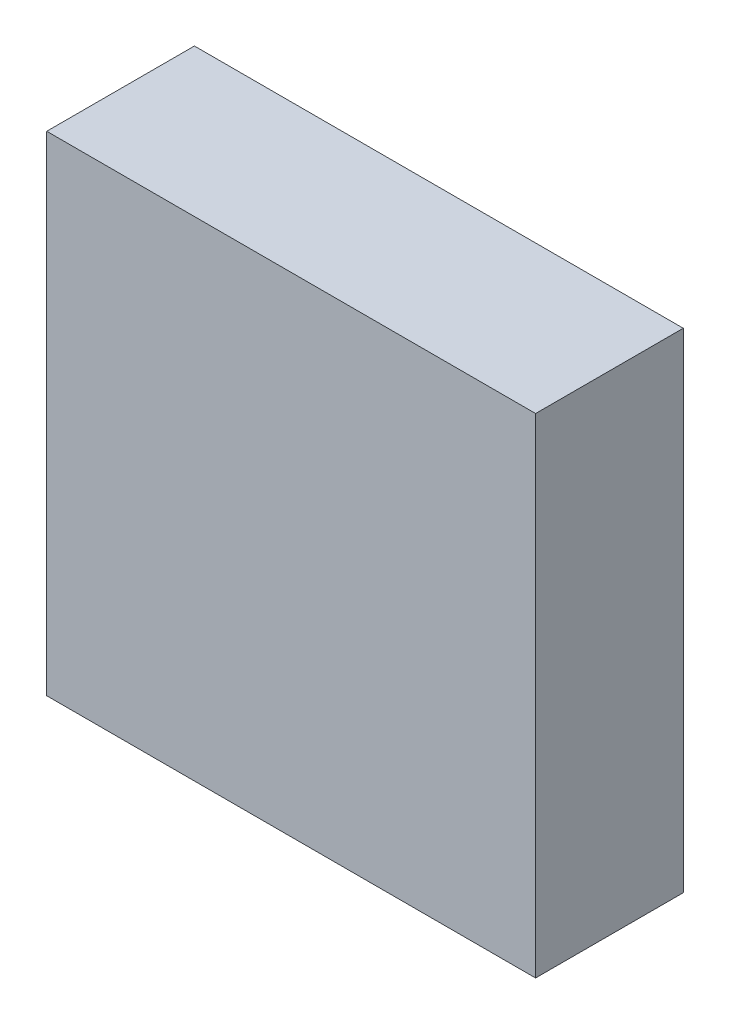
from build123d import *

# Parameters (mm, degrees)
SKETCH_1_W           = 36
SKETCH_1_H           = 36
SCREW_FOOT_PAD_DEPTH = 10.875238336


with BuildPart() as part:
    # 草图1 → Screw_foot_pad (new body)
    with BuildSketch(Plane.XY):
        with Locations((18, 18)):
            Rectangle(SKETCH_1_W, SKETCH_1_H)
    extrude(amount=SCREW_FOOT_PAD_DEPTH)


solid = part.part
